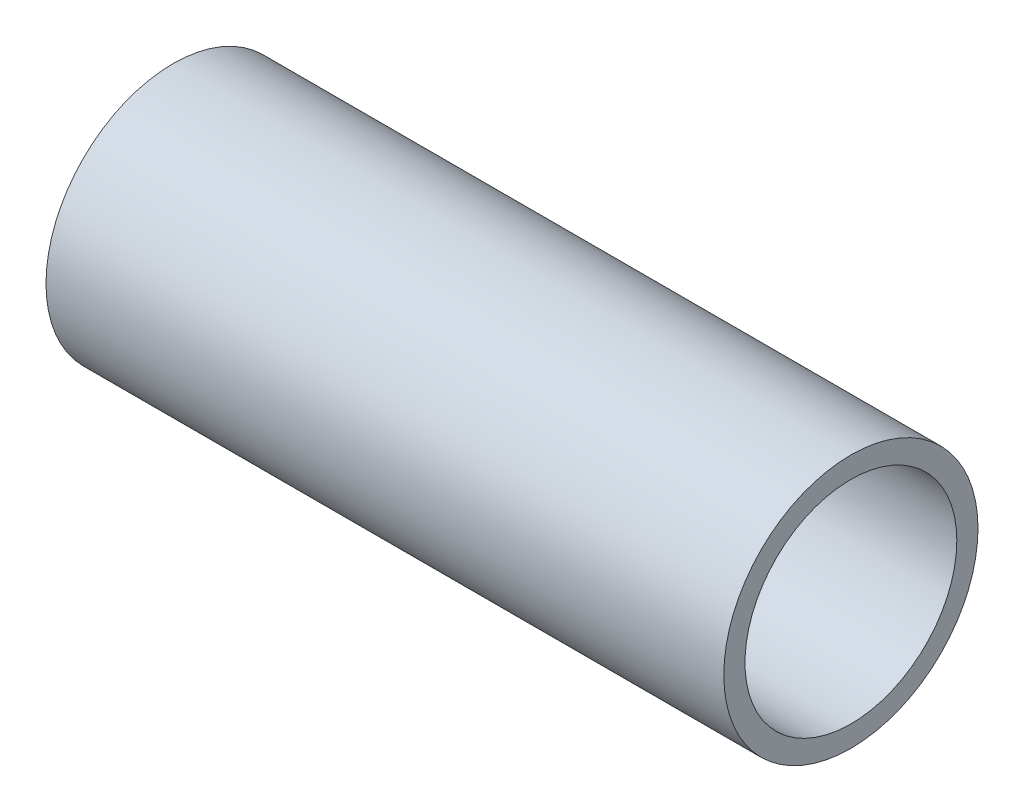
from build123d import *

# Parameters (mm, degrees)
SKETCH1_R           = 6
SKETCH1_R_2         = 5
BOSS_EXTRUDE1_DEPTH = 32


with BuildPart() as part:
    # Sketch1 → Boss-Extrude1 (new body)
    with BuildSketch(Plane(origin=(0, 0, 0), x_dir=(0, 0, -1), z_dir=(1, 0, 0))):
        Circle(SKETCH1_R)
        Circle(SKETCH1_R_2, mode=Mode.SUBTRACT)
    extrude(amount=BOSS_EXTRUDE1_DEPTH)


solid = part.part
